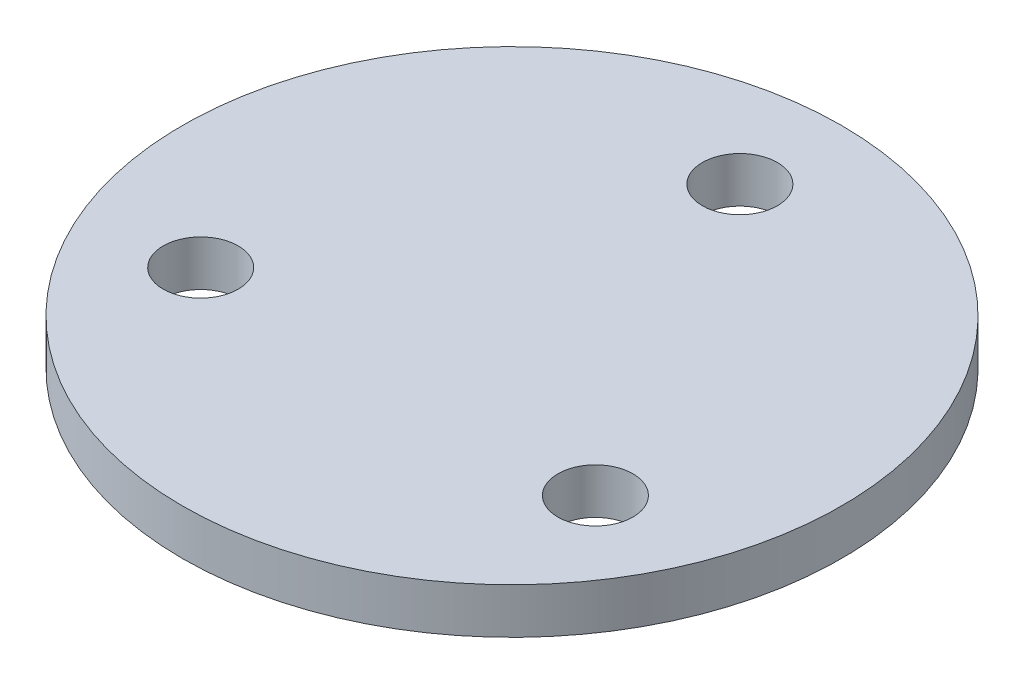
from build123d import *

# Parameters (mm, degrees)
SKETCH1_R           = 11.938
BOSS_EXTRUDE1_DEPTH = 1.651
SKETCH2_R           = 1.3589
CUT_EXTRUDE1_DEPTH  = 1.651
CIRPATTERN1_COUNT   = 3


with BuildPart() as part:
    # Sketch1 → Boss-Extrude1 (new body)
    with BuildSketch(Plane(origin=(0, 0, 0), x_dir=(1, 0, 0), z_dir=(0, 1, 0))):
        with Locations(Location((0, 0, 0), (0, 0, 90))):
            Circle(SKETCH1_R)
    extrude(amount=BOSS_EXTRUDE1_DEPTH)

    # Sketch2 → Cut-Extrude1 (cut)
    with BuildSketch(Plane(origin=(0, 1.651, 0), x_dir=(1, 0, 0), z_dir=(0, 1, 0))):
        with Locations(Location((0, 8.255, 0), (0, 0, 270))):
            Circle(SKETCH2_R)
    cut_extrude1 = extrude(amount=-CUT_EXTRUDE1_DEPTH, mode=Mode.SUBTRACT)

    # CirPattern1: Cut-Extrude1 ×3 about axis
    cirpattern1_axis = Axis((0, 0, 0), (0, 1, 0))
    for i in range(1, CIRPATTERN1_COUNT):
        add(cut_extrude1.rotate(cirpattern1_axis, i * 360 / CIRPATTERN1_COUNT), mode=Mode.SUBTRACT)


solid = part.part
